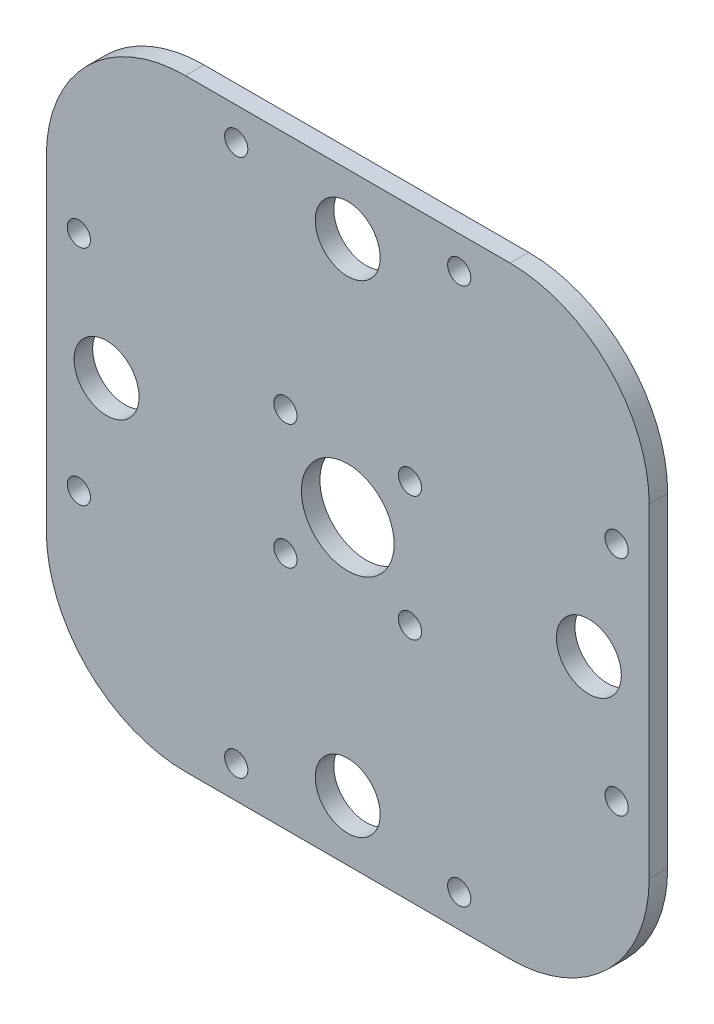
from build123d import *

# Parameters (mm, degrees)
CROQUIS1_W              = 65
CROQUIS1_H              = 65
CROQUIS1_R              = 5
CROQUIS1_R_2            = 1.25
SALIENTE_EXTRUIR1_DEPTH = 2
REDONDEO1_R             = 15
CROQUIS2_R              = 3.5
CORTAR_EXTRUIR1_DEPTH   = 2
CROQUIS3_R              = 1.25
CORTAR_EXTRUIR2_DEPTH   = 2


with BuildPart() as part:
    # Croquis1 → Saliente-Extruir1 (new body)
    with BuildSketch(Plane.XY):
        Rectangle(CROQUIS1_W, CROQUIS1_H)
        Circle(CROQUIS1_R, mode=Mode.SUBTRACT)
        with Locations((-6.717514421, 6.717514421)):
            Circle(CROQUIS1_R_2, mode=Mode.SUBTRACT)
        with Locations((6.717514421, 6.717514421)):
            Circle(CROQUIS1_R_2, mode=Mode.SUBTRACT)
        with Locations((6.717514421, -6.717514421)):
            Circle(CROQUIS1_R_2, mode=Mode.SUBTRACT)
        with Locations((-6.717514421, -6.717514421)):
            Circle(CROQUIS1_R_2, mode=Mode.SUBTRACT)
    extrude(amount=SALIENTE_EXTRUIR1_DEPTH)

    # Redondeo1
    redondeo1_edges = [part.edges().sort_by_distance(p)[0] for p in [
        (32.5, -32.5, 1),
        (-32.5, -32.5, 1),
        (-32.5, 32.5, 1),
        (32.5, 32.5, 1),
    ]]
    fillet(redondeo1_edges, radius=REDONDEO1_R)

    # Croquis2 → Cortar-Extruir1 (cut)
    with BuildSketch(Plane.XY.offset(2)):
        with Locations((-26, 0)):
            Circle(CROQUIS2_R)
        with Locations((0, 26)):
            Circle(CROQUIS2_R)
        with Locations((26, 0)):
            Circle(CROQUIS2_R)
        with Locations((0, -26)):
            Circle(CROQUIS2_R)
    extrude(amount=-CORTAR_EXTRUIR1_DEPTH, mode=Mode.SUBTRACT)

    # Croquis3 → Cortar-Extruir2 (cut)
    with BuildSketch(Plane.XY.offset(2)):
        with Locations((-28.991378029, 12.02081528)):
            Circle(CROQUIS3_R)
        with Locations(Location((-12.02081528, 28.991378029, 0), (0, 0, 180))):
            Circle(CROQUIS3_R)
        with Locations((12.02081528, 28.991378029)):
            Circle(CROQUIS3_R)
        with Locations(Location((28.991378029, 12.02081528, 0), (0, 0, 180))):
            Circle(CROQUIS3_R)
        with Locations((28.991378029, -12.02081528)):
            Circle(CROQUIS3_R)
        with Locations(Location((12.02081528, -28.991378029, 0), (0, 0, 180))):
            Circle(CROQUIS3_R)
        with Locations((-12.02081528, -28.991378029)):
            Circle(CROQUIS3_R)
        with Locations(Location((-28.991378029, -12.02081528, 0), (0, 0, 180))):
            Circle(CROQUIS3_R)
    extrude(amount=-CORTAR_EXTRUIR2_DEPTH, mode=Mode.SUBTRACT)


solid = part.part
